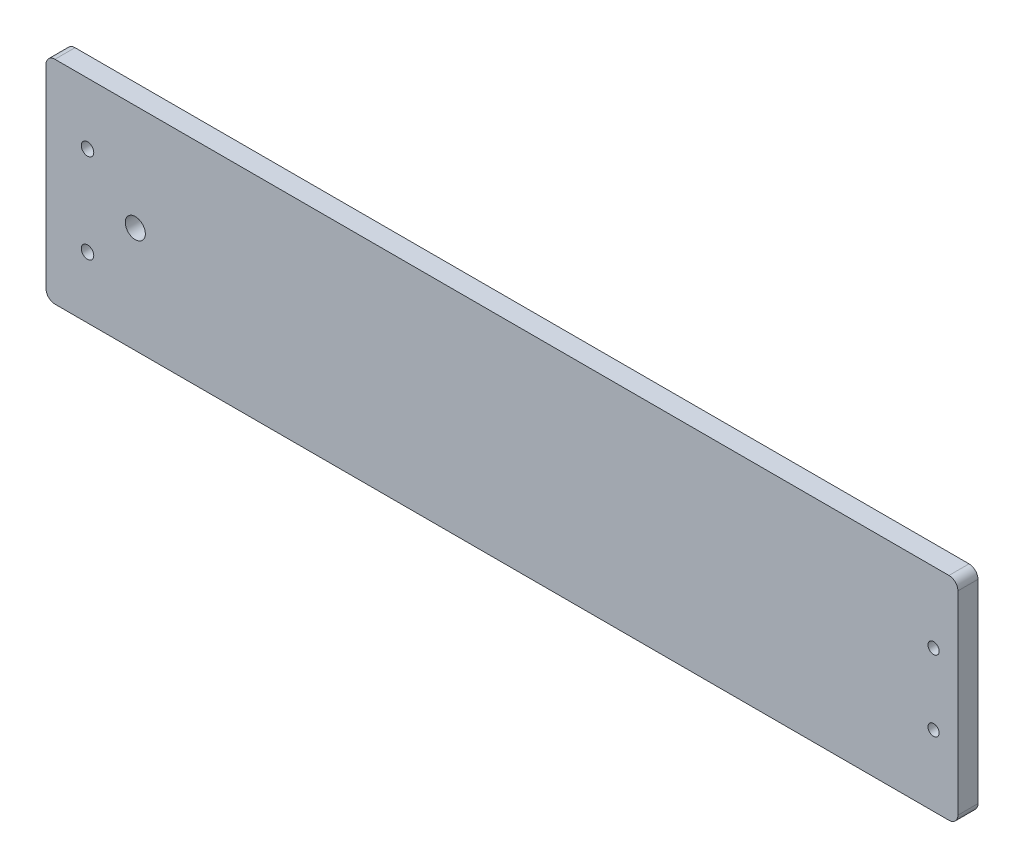
from build123d import *

# Parameters (mm, degrees)
SKETCH1_W                      = 204.24
SKETCH1_H                      = 47.5
BOSS_EXTRUDE1_DEPTH            = 2.25
F_8_CLEARANCE_HOLE1_D          = 4.4958
FILLET1_R                      = 2
F_3_CLEARANCE_HOLE1_D          = 2.794
F_2_0_221_DIAMETER_HOLE1_D     = 2.50000008
F_2_0_221_DIAMETER_HOLE1_DEPTH = 20
F_2_0_221_DIAMETER_HOLE1_TIP   = 0.751075798


with BuildPart() as part:
    # Sketch1 → Boss-Extrude1 (new, symmetric)
    with BuildSketch(Plane.XY):
        Rectangle(SKETCH1_W, SKETCH1_H)
    extrude(amount=BOSS_EXTRUDE1_DEPTH, both=True)

    # #8 Clearance Hole1 (through all)
    with Locations(Plane.XY.offset(2.25)):
        with Locations((-82.12, 0)):
            Hole(F_8_CLEARANCE_HOLE1_D / 2)

    # Fillet1
    fillet1_edges = [part.edges().sort_by_distance(p)[0] for p in [
        (-102.12, 23.75, 0),
        (102.12, 23.75, 0),
        (102.12, -23.75, 0),
        (-102.12, -23.75, 0),
    ]]
    fillet(fillet1_edges, radius=FILLET1_R)

    # #3 Clearance Hole1 (through all)
    with Locations(Plane.XY.offset(2.25)):
        with Locations((-92.82, 10), (-92.82, -10)):
            Hole(F_3_CLEARANCE_HOLE1_D / 2)

    # #2 (0.221) Diameter Hole1
    with Locations(Plane(origin=(0, 0, -2.25), x_dir=(-1, 0, 0), z_dir=(0, 0, -1))):
        with Locations((-96.666875, 7.9375), (-96.666875, -7.9375)):
            Hole(F_2_0_221_DIAMETER_HOLE1_D / 2, depth=F_2_0_221_DIAMETER_HOLE1_DEPTH)
            with Locations((0, 0, -(F_2_0_221_DIAMETER_HOLE1_DEPTH + F_2_0_221_DIAMETER_HOLE1_TIP / 2))):  # 118° drill point
                Cone(0, F_2_0_221_DIAMETER_HOLE1_D / 2, F_2_0_221_DIAMETER_HOLE1_TIP, mode=Mode.SUBTRACT)


solid = part.part
